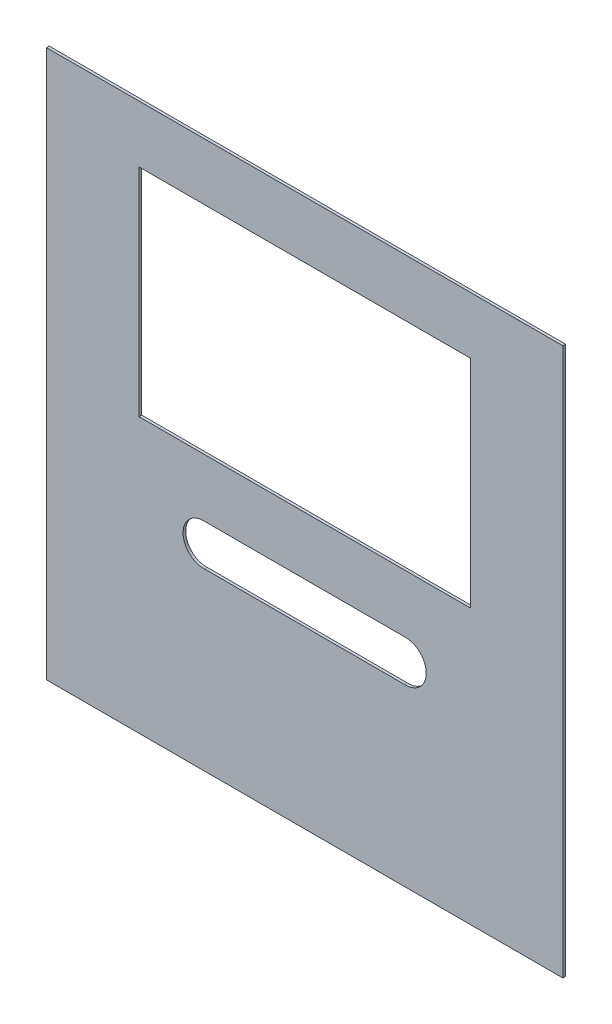
from build123d import *

# Parameters (mm, degrees)
SKETCH1_W           = 382
SKETCH1_H           = 405
BOSS_EXTRUDE1_DEPTH = 2
CUT_EXTRUDE1_DEPTH  = 296.144032635
SKETCH3_W           = 267
SKETCH3_H           = 157
BOSS_EXTRUDE2_DEPTH = 15
SKETCH4_W           = 261
SKETCH4_H           = 151
CUT_EXTRUDE2_DEPTH  = 15
SKETCH5_W           = 245
SKETCH5_H           = 160
CUT_EXTRUDE3_DEPTH  = 296.51818895
SKETCH7_W           = 15
SKETCH7_H           = 157
CUT_EXTRUDE4_DEPTH  = 395.657042985
BOSS_EXTRUDE3_START = -2
BOSS_EXTRUDE3_DEPTH = 2
CUT_EXTRUDE5_DEPTH  = 296.144032635


with BuildPart() as part:
    # Sketch1 → Boss-Extrude1 (new body)
    with BuildSketch(Plane(origin=(0, 0, 0), x_dir=(-1, 0, 0), z_dir=(0, 0, -1))):
        with Locations((0, 22.5)):
            Rectangle(SKETCH1_W, SKETCH1_H)
    extrude(amount=-BOSS_EXTRUDE1_DEPTH)

    # Sketch2 → Cut-Extrude1 (cut, through all)
    with BuildSketch(Plane.XY.offset(2)):
        with BuildLine():
            Line((-75.5, -35.65), (75.482536693, -35.65))
            ThreePointArc((75.482536693, -35.65), (60.004590726, -20), (75.482536693, -4.35))
            Line((75.482536693, -4.35), (-75.5, -4.35))
            ThreePointArc((-75.5, -4.35), (-91.15, -20), (-75.5, -35.65))
        make_face()
    extrude(amount=-CUT_EXTRUDE1_DEPTH, mode=Mode.SUBTRACT)

    # Sketch3 → Boss-Extrude2 (add)
    with BuildSketch(Plane(origin=(0, 0, 0), x_dir=(-1, 0, 0), z_dir=(0, 0, -1))):
        with Locations((-0.610849862, 98.314505171)):
            Rectangle(SKETCH3_W, SKETCH3_H)
    extrude(amount=BOSS_EXTRUDE2_DEPTH)

    # Sketch4 → Cut-Extrude2 (cut)
    with BuildSketch(Plane(origin=(0, 0, -15), x_dir=(-1, 0, 0), z_dir=(0, 0, -1))):
        with Locations((-0.610849862, 98.314505171)):
            Rectangle(SKETCH4_W, SKETCH4_H)
    extrude(amount=-CUT_EXTRUDE2_DEPTH, mode=Mode.SUBTRACT)

    # Sketch5 → Cut-Extrude3 (cut, through all)
    with BuildSketch(Plane(origin=(0, 0, 0), x_dir=(-1, 0, 0), z_dir=(0, 0, -1))):
        with Locations((0, 102.814505171)):
            Rectangle(SKETCH5_W, SKETCH5_H)
    extrude(amount=-CUT_EXTRUDE3_DEPTH, mode=Mode.SUBTRACT)

    # Sketch7 → Cut-Extrude4 (cut, through all)
    with BuildSketch(Plane.ZY.offset(132.889150138)):
        with Locations((-7.5, 98.314505171)):
            Rectangle(SKETCH7_W, SKETCH7_H)
    extrude(amount=-CUT_EXTRUDE4_DEPTH, mode=Mode.SUBTRACT)

    # Sketch9 → Boss-Extrude3 (add)
    with BuildSketch(Plane(origin=(0, 0, 0), x_dir=(-1, 0, 0), z_dir=(0, 0, -1)).offset(BOSS_EXTRUDE3_START)):
        with BuildLine():
            Line((75.5, -35.65), (-75.482536693, -35.65))
            ThreePointArc((-75.482536693, -35.65), (-60.004590726, -20), (-75.482536693, -4.35))
            Line((-75.482536693, -4.35), (75.5, -4.35))
            ThreePointArc((75.5, -4.35), (91.15, -20), (75.5, -35.65))
        make_face()
    extrude(amount=BOSS_EXTRUDE3_DEPTH)

    # Sketch8 → Cut-Extrude5 (cut, through all)
    with BuildSketch(Plane(origin=(0, 0, 0), x_dir=(-1, 0, 0), z_dir=(0, 0, -1))):
        with BuildLine():
            Line((-73.827773505, -20), (73.827773505, -20))
            ThreePointArc((73.827773505, -20), (89.945940018, -35.25), (73.827773505, -50.5))
            Line((73.827773505, -50.5), (-73.827773505, -50.5))
            ThreePointArc((-73.827773505, -50.5), (-89.945940018, -35.25), (-73.827773505, -20))
        make_face()
    extrude(amount=-CUT_EXTRUDE5_DEPTH, mode=Mode.SUBTRACT)


solid = part.part
